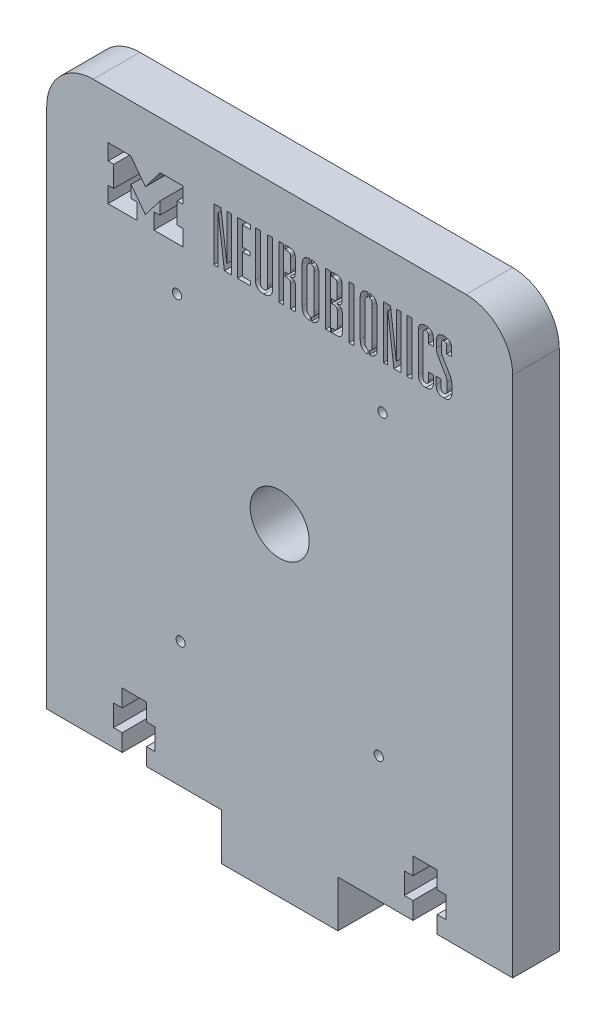
from build123d import *

# Parameters (mm, degrees)
SKETCH1_W             = 127
SKETCH1_H             = 155
BOSS_EXTRUDE1_DEPTH   = 12.7
SKETCH2_W             = 6.604
SKETCH2_H             = 4.699
SKETCH2_H_2           = 5.842
SKETCH2_W_2           = 2.3622
CUT_EXTRUDE1_DEPTH    = 201.786677845
FILLET1_R             = 12.7
SKETCH11_W            = 31.75
SKETCH11_H            = 12.7
BOSS_EXTRUDE2_DEPTH   = 12.7
CUT_EXTRUDE9_DEPTH    = 201.786677845
SKETCH19_W            = 1.320165
SKETCH19_H            = 14.40446524
CUT_EXTRUDE10_DEPTH   = 201.786677845
SKETCH21_R            = 8.05
CUT_EXTRUDE11_DEPTH   = 201.786677992
M3X0_5_TAPPED_HOLE1_D = 2.5
FILLET2_R             = 0.25


with BuildPart() as part:
    # Sketch1 → Boss-Extrude1 (new body)
    with BuildSketch(Plane.XY):
        with Locations((63.5, 77.5)):
            Rectangle(SKETCH1_W, SKETCH1_H)
    extrude(amount=BOSS_EXTRUDE1_DEPTH)

    # Sketch2 → Cut-Extrude1 (cut, through all)
    with BuildSketch(Plane.XY.offset(12.7)):
        with Locations((23.876, 12.8905)):
            Rectangle(SKETCH2_W, SKETCH2_H)
        with Locations((23.876, 7.62)):
            Rectangle(SKETCH2_W, SKETCH2_H_2)
        with Locations((28.3591, 7.62)):
            Rectangle(SKETCH2_W_2, SKETCH2_H_2)
        with Locations((19.3929, 7.62)):
            Rectangle(SKETCH2_W_2, SKETCH2_H_2)
        with Locations((23.876, 2.3495)):
            Rectangle(SKETCH2_W, SKETCH2_H)
        with Locations((103.124, 2.3495)):
            Rectangle(SKETCH2_W, SKETCH2_H)
        with Locations((103.124, 7.62)):
            Rectangle(SKETCH2_W, SKETCH2_H_2)
        with Locations((107.6071, 7.62)):
            Rectangle(SKETCH2_W_2, SKETCH2_H_2)
        with Locations((103.124, 12.8905)):
            Rectangle(SKETCH2_W, SKETCH2_H)
        with Locations((98.6409, 7.62)):
            Rectangle(SKETCH2_W_2, SKETCH2_H_2)
    extrude(amount=-CUT_EXTRUDE1_DEPTH, mode=Mode.SUBTRACT)

    # Fillet1
    fillet1_edges = [part.edges().sort_by_distance(p)[0] for p in [
        (0, 155, 6.35),
        (127, 155, 6.35),
    ]]
    fillet(fillet1_edges, radius=FILLET1_R)

    # Sketch11 → Boss-Extrude2 (add)
    with BuildSketch(Plane.XZ):
        with Locations((63.5, 6.35)):
            Rectangle(SKETCH11_W, SKETCH11_H)
    extrude(amount=BOSS_EXTRUDE2_DEPTH)

    # Sketch20 → Cut-Extrude9 (cut, through all)
    with BuildSketch(Plane.XY.offset(12.7)):
        Polygon((22.97667018, 131.97336552), (24.604291259, 131.97336552), (24.604291259, 127.640619868), (16.714850296, 127.640619868), (16.714850296, 131.97336552), (18.254329992, 131.97336552), (18.254329992, 137.700621193), (16.714056676, 137.700621193), (16.714056676, 142.045085108), (22.890341603, 142.045085108), (26.901674355, 136.730226684), (30.913007108, 142.045085108), (37.089292035, 142.045085108), (37.089292035, 137.700621193), (35.549018719, 137.700621193), (35.549018719, 131.97336552), (37.088498415, 131.97336552), (37.088498415, 127.640619868), (29.199057452, 127.640619868), (29.199057452, 131.97336552), (30.826678531, 131.97336552), (30.826678531, 135.321098969), (26.901674355, 130.12062252), (22.97667018, 135.321098969), align=None)
    extrude(amount=-CUT_EXTRUDE9_DEPTH, mode=Mode.SUBTRACT)

    # Sketch19 → Cut-Extrude10 (cut, through all)
    with BuildSketch(Plane.XY.offset(12.7)):
        with BuildLine():
            Line((64.919332717, 135.678954152), (64.919332717, 134.564150108))
            Line((64.919332717, 134.564150108), (65.415267123, 134.564150108))
            add(Edge.make_bspline(
                [(66.456730818, 133.684040108), (66.456730818, 134.388128108), (66.031344123, 134.564150108), (65.415267123, 134.564150108)],
                knots=[0, 0, 0, 0, 1, 1, 1, 1], degree=3))
            Line((66.456730818, 133.684040108), (66.442061927, 133.684023484))
            Line((66.442061927, 133.684023484), (66.442061927, 127.640603244))
            Line((66.442061927, 127.640603244), (67.796402522, 127.640603244))
            Line((67.796402522, 127.640603244), (67.796402522, 133.801373244))
            add(Edge.make_bspline(
                [(66.300215522, 135.136207722), (67.238999913, 135.077535482), (67.796402522, 134.7988332), (67.796402522, 133.801373244)],
                knots=[0, 0, 0, 0, 1, 1, 1, 1], degree=3))
            Line((66.300215522, 135.136207722), (66.300215522, 135.180227108))
            add(Edge.make_bspline(
                [(67.737728717, 136.735086152), (67.737728717, 135.620282108), (67.312342022, 135.238899152), (66.300215522, 135.180227108)],
                knots=[0, 0, 0, 0, 1, 1, 1, 1], degree=3))
            Line((67.737728717, 136.735086152), (67.737728717, 140.387545586))
            add(Edge.make_bspline(
                [(65.698807413, 142.045085108), (66.960298022, 142.045085108), (67.737728717, 141.825060346), (67.737728717, 140.387545586)],
                knots=[0, 0, 0, 0, 1, 1, 1, 1], degree=3))
            Line((65.698807413, 142.045085108), (64.919332717, 142.045085108))
            Line((64.919332717, 142.045085108), (64.919332717, 140.930280868))
            Line((64.919332717, 140.930280868), (65.378467238, 140.930280868))
            add(Edge.make_bspline(
                [(66.493273629, 139.947490586), (66.493273629, 140.783592152), (66.053218629, 140.930280868), (65.378467238, 140.930280868)],
                knots=[0, 0, 0, 0, 1, 1, 1, 1], degree=3))
            Line((66.493273629, 139.947490586), (66.493273629, 136.720422346))
            add(Edge.make_bspline(
                [(65.510483738, 135.678954152), (66.126560738, 135.678954152), (66.493273629, 135.854976152), (66.493273629, 136.720422346)],
                knots=[0, 0, 0, 0, 1, 1, 1, 1], degree=3))
            Line((65.510483738, 135.678954152), (64.919332717, 135.678954152))
        make_face()
        Polygon((64.569332717, 140.93031325), (64.569332717, 142.045085108), (63.249167717, 142.045085108), (63.249167717, 127.640619868), (64.569332717, 127.640619868), align=None)
        Polygon((46.761773522, 140.44621763), (46.717770955, 140.44621763), (46.717770955, 127.640619868), (45.558959455, 127.640619868), (45.558959455, 142.045085108), (47.480533151, 142.045085108), (49.094067955, 129.723545108), (49.138070522, 129.723545108), (49.138070522, 142.045085108), (50.296882413, 142.045085108), (50.296882413, 127.640619868), (48.419314217, 127.640619868), align=None)
        with BuildLine():
            Line((58.217872413, 142.045085108), (58.217872413, 130.002247586))
            add(Edge.make_bspline(
                [(58.217872413, 130.002247586), (58.217872413, 128.960784868), (58.555247522, 128.65274363), (59.215330022, 128.65274363)],
                knots=[0, 0, 0, 0, 1, 1, 1, 1], degree=3))
            add(Edge.make_bspline(
                [(59.215330022, 128.65274363), (59.890081413, 128.65274363), (60.212788217, 128.975454346), (60.212788217, 130.002247586)],
                knots=[0, 0, 0, 0, 1, 1, 1, 1], degree=3))
            Line((60.212788217, 130.002247586), (60.212788217, 142.045085108))
            Line((60.212788217, 142.045085108), (61.518284913, 142.045085108))
            Line((61.518284913, 142.045085108), (61.518284913, 129.576861868))
            add(Edge.make_bspline(
                [(61.518284913, 129.576861868), (61.518284913, 127.977994586), (60.315467522, 127.523270108), (59.185993413, 127.523270108)],
                knots=[0, 0, 0, 0, 1, 1, 1, 1], degree=3))
            add(Edge.make_bspline(
                [(59.185993413, 127.523270108), (58.085855913, 127.523270108), (56.897707413, 127.977994586), (56.897707413, 129.576861868)],
                knots=[0, 0, 0, 0, 1, 1, 1, 1], degree=3))
            Line((56.897707413, 129.576861868), (56.897707413, 142.045085108))
            Line((56.897707413, 142.045085108), (58.217872413, 142.045085108))
        make_face()
        with BuildLine():
            Line((74.230211032, 139.727460153), (74.230211032, 129.958239152))
            add(Edge.make_bspline(
                [(74.230211032, 129.958239152), (74.230211032, 128.588188835), (73.727002155, 127.598938483), (72.105088423, 127.527419045)],
                knots=[0, 0, 0, 0, 0.962898501, 0.962898501, 0.962898501, 0.962898501], degree=3))
            Line((72.105088423, 127.527419045), (72.105088423, 128.649158115))
            add(Edge.make_bspline(
                [(72.105088423, 128.649158115), (72.774089716, 128.731143819), (72.910046032, 129.260484228), (72.910046032, 129.987578109)],
                knots=[0.082066912, 0.082066912, 0.082066912, 0.082066912, 1, 1, 1, 1], degree=3))
            Line((72.910046032, 129.987578109), (72.910046032, 139.683457587))
            add(Edge.make_bspline(
                [(72.910046032, 139.683457587), (72.910046032, 140.410551468), (72.774089716, 140.939891712), (72.105088423, 141.021877389)],
                knots=[0, 0, 0, 0, 0.917933088, 0.917933088, 0.917933088, 0.917933088], degree=3))
            Line((72.105088423, 141.021877389), (72.105088423, 142.158285932))
            add(Edge.make_bspline(
                [(72.105088423, 142.158285932), (73.727002155, 142.086766486), (74.230211032, 141.097515931), (74.230211032, 139.727460153)],
                knots=[0.037101499, 0.037101499, 0.037101499, 0.037101499, 1, 1, 1, 1], degree=3))
        make_face()
        Polygon((77.316259413, 134.564150108), (77.316259413, 128.755424108), (77.316259413, 127.640603244), (76.010762717, 127.640603244), (76.010762717, 142.045085108), (77.316259413, 142.045085108), (77.316259413, 140.930280868), (77.316259413, 135.678954152), align=None)
        Polygon((94.625086479, 127.640619868), (92.967546957, 140.44621763), (92.923527571, 140.44621763), (92.923527571, 127.640619868), (91.764715093, 127.640619868), (91.764715093, 142.045085108), (93.686287811, 142.045085108), (95.299824571, 129.723545108), (95.343843957, 129.723545108), (95.343843957, 142.045085108), (96.502656435, 142.045085108), (96.502656435, 127.640619868), align=None)
        with BuildLine():
            Line((104.056932957, 129.547523108), (104.056932957, 131.55710663))
            Line((104.056932957, 131.55710663), (105.377097957, 131.55710663))
            Line((105.377097957, 131.55710663), (105.377097957, 129.503520346))
            add(Edge.make_bspline(
                [(105.377097957, 129.503520346), (105.377097957, 128.286030152), (104.702348717, 127.50860063), (103.323511673, 127.50860063)],
                knots=[0, 0, 0, 0, 1, 1, 1, 1], degree=3))
            add(Edge.make_bspline(
                [(103.323511673, 127.50860063), (101.944668957, 127.50860063), (101.269919717, 128.286030152), (101.269919717, 129.503520346)],
                knots=[0, 0, 0, 0, 1, 1, 1, 1], degree=3))
            Line((101.269919717, 129.503520346), (101.269919717, 140.152851346))
            add(Edge.make_bspline(
                [(101.269919717, 140.152851346), (101.269919717, 141.370335868), (101.944668957, 142.147765586), (103.323511673, 142.147765586)],
                knots=[0, 0, 0, 0, 1, 1, 1, 1], degree=3))
            add(Edge.make_bspline(
                [(103.323511673, 142.147765586), (104.702348717, 142.147765586), (105.377097957, 141.370335868), (105.377097957, 140.152851346)],
                knots=[0, 0, 0, 0, 1, 1, 1, 1], degree=3))
            Line((105.377097957, 140.152851346), (105.377097957, 138.275281586))
            Line((105.377097957, 138.275281586), (104.056932957, 138.275281586))
            Line((104.056932957, 138.275281586), (104.056932957, 140.123512586))
            add(Edge.make_bspline(
                [(104.056932957, 140.123512586), (104.056932957, 140.739589586), (103.836908195, 141.047625152), (103.323511673, 141.047625152)],
                knots=[0, 0, 0, 0, 1, 1, 1, 1], degree=3))
            add(Edge.make_bspline(
                [(103.323511673, 141.047625152), (102.810109479, 141.047625152), (102.590084717, 140.754258868), (102.590084717, 140.123512586)],
                knots=[0, 0, 0, 0, 1, 1, 1, 1], degree=3))
            Line((102.590084717, 140.123512586), (102.590084717, 129.547523108))
            add(Edge.make_bspline(
                [(102.590084717, 129.547523108), (102.590084717, 128.931446108), (102.810109479, 128.623410346), (103.323511673, 128.623410346)],
                knots=[0, 0, 0, 0, 1, 1, 1, 1], degree=3))
            add(Edge.make_bspline(
                [(103.323511673, 128.623410346), (103.836908195, 128.623410346), (104.056932957, 128.91677663), (104.056932957, 129.547523108)],
                knots=[0, 0, 0, 0, 1, 1, 1, 1], degree=3))
        make_face()
        with BuildLine():
            Line((107.533370195, 140.064840346), (107.533370195, 138.553983868))
            add(Edge.make_bspline(
                [(107.533370195, 138.553983868), (107.533370195, 138.099259586), (107.606711717, 137.62986563), (107.826736479, 137.263152152)],
                knots=[0, 0, 0, 0, 1, 1, 1, 1], degree=3))
            Line((107.826736479, 137.263152152), (109.924336673, 133.66937063))
            add(Edge.make_bspline(
                [(109.924336673, 133.66937063), (110.217702957, 133.170643586), (110.408394435, 132.554566586), (110.408394435, 131.90915063)],
                knots=[0, 0, 0, 0, 1, 1, 1, 1], degree=3))
            Line((110.408394435, 131.90915063), (110.408394435, 129.635534108))
            add(Edge.make_bspline(
                [(110.408394435, 129.635534108), (110.408394435, 128.286030152), (109.616295435, 127.523270108), (108.296130435, 127.523270108)],
                knots=[0, 0, 0, 0, 1, 1, 1, 1], degree=3))
            add(Edge.make_bspline(
                [(108.296130435, 127.523270108), (106.843951673, 127.523270108), (106.139863673, 128.183355346), (106.139863673, 129.635534108)],
                knots=[0, 0, 0, 0, 1, 1, 1, 1], degree=3))
            Line((106.139863673, 129.635534108), (106.139863673, 131.615784346))
            Line((106.139863673, 131.615784346), (107.460028673, 131.615784346))
            Line((107.460028673, 131.615784346), (107.460028673, 129.723545108))
            add(Edge.make_bspline(
                [(107.460028673, 129.723545108), (107.460028673, 129.048795868), (107.724061673, 128.65274363), (108.296130435, 128.65274363)],
                knots=[0, 0, 0, 0, 1, 1, 1, 1], degree=3))
            add(Edge.make_bspline(
                [(108.296130435, 128.65274363), (108.838865717, 128.65274363), (109.088229435, 129.048795868), (109.088229435, 129.723545108)],
                knots=[0, 0, 0, 0, 1, 1, 1, 1], degree=3))
            Line((109.088229435, 129.723545108), (109.088229435, 131.73312863))
            add(Edge.make_bspline(
                [(109.088229435, 131.73312863), (109.088229435, 132.231861346), (108.985548957, 132.61323863), (108.706846479, 133.111971346)],
                knots=[0, 0, 0, 0, 1, 1, 1, 1], degree=3))
            Line((108.706846479, 133.111971346), (106.770604479, 136.48572263))
            add(Edge.make_bspline(
                [(106.770604479, 136.48572263), (106.418560479, 137.10179963), (106.213205195, 137.585862868), (106.213205195, 138.319284152)],
                knots=[0, 0, 0, 0, 1, 1, 1, 1], degree=3))
            Line((106.213205195, 138.319284152), (106.213205195, 140.050170868))
            add(Edge.make_bspline(
                [(106.213205195, 140.050170868), (106.213205195, 141.473016346), (106.946626479, 142.162434868), (108.281460957, 142.162434868)],
                knots=[0, 0, 0, 0, 1, 1, 1, 1], degree=3))
            add(Edge.make_bspline(
                [(108.281460957, 142.162434868), (109.762978479, 142.162434868), (110.349722195, 141.458346868), (110.349722195, 140.152851346)],
                knots=[0, 0, 0, 0, 1, 1, 1, 1], degree=3))
            Line((110.349722195, 140.152851346), (110.349722195, 138.319284152))
            Line((110.349722195, 138.319284152), (109.029557195, 138.319284152))
            Line((109.029557195, 138.319284152), (109.029557195, 140.064840346))
            Line((109.029557195, 140.064840346), (109.058890479, 140.064840346))
            add(Edge.make_bspline(
                [(109.058890479, 140.064840346), (109.058890479, 140.62223963), (108.912207435, 141.047625152), (108.296130435, 141.047625152)],
                knots=[0, 0, 0, 0, 1, 1, 1, 1], degree=3))
            add(Edge.make_bspline(
                [(108.296130435, 141.047625152), (107.680053435, 141.047625152), (107.533370195, 140.62223963), (107.533370195, 140.064840346)],
                knots=[0, 0, 0, 0, 1, 1, 1, 1], degree=3))
        make_face()
        with BuildLine():
            Line((85.442609195, 129.958239152), (85.442609195, 139.727460153))
            add(Edge.make_bspline(
                [(85.442609195, 139.727460153), (85.442609195, 141.097515797), (85.945819062, 142.086766292), (87.567728479, 142.158285911)],
                knots=[0, 0, 0, 0, 0.962898407, 0.962898407, 0.962898407, 0.962898407], degree=3))
            Line((87.567728479, 142.158285911), (87.567728479, 141.021877309))
            add(Edge.make_bspline(
                [(87.567728479, 141.021877309), (86.898729931, 140.939891377), (86.762774195, 140.410551237), (86.762774195, 139.683457585)],
                knots=[0.0820672, 0.0820672, 0.0820672, 0.0820672, 1, 1, 1, 1], degree=3))
            Line((86.762774195, 139.683457585), (86.762774195, 129.987578107))
            add(Edge.make_bspline(
                [(86.762774195, 129.987578107), (86.762774195, 129.260484455), (86.898729931, 128.731144151), (87.567728479, 128.649158191)],
                knots=[0, 0, 0, 0, 0.917932799, 0.917932799, 0.917932799, 0.917932799], degree=3))
            Line((87.567728479, 128.649158191), (87.567728479, 127.527419066))
            add(Edge.make_bspline(
                [(87.567728479, 127.527419066), (85.945819062, 127.598938677), (85.442609195, 128.58818897), (85.442609195, 129.958239152)],
                knots=[0.037101593, 0.037101593, 0.037101593, 0.037101593, 1, 1, 1, 1], degree=3))
        make_face()
        with Locations((98.849617217, 134.842852488)):
            Rectangle(SKETCH19_W, SKETCH19_H)
        Polygon((53.318593022, 135.678954152), (55.386851522, 135.678954152), (55.386851522, 134.564150108), (53.318593022, 134.564150108), (53.318593022, 128.755424108), (55.489531413, 128.755424108), (55.489531413, 127.640619868), (51.998428022, 127.640619868), (51.998428022, 142.045085108), (55.489531413, 142.045085108), (55.489531413, 140.930280868), (53.318593022, 140.930280868), align=None)
        with BuildLine():
            Line((80.499323717, 140.387545586), (80.499323717, 136.735086152))
            add(Edge.make_bspline(
                [(80.499323717, 136.735086152), (80.499323717, 135.620282108), (80.073938195, 135.224235346), (79.061810522, 135.180227108)],
                knots=[0, 0, 0, 0, 1, 1, 1, 1], degree=3))
            Line((79.061810522, 135.180227108), (79.061810522, 135.136207722))
            add(Edge.make_bspline(
                [(79.061810522, 135.136207722), (79.985927195, 135.092188336), (80.557995957, 134.7988332), (80.557995957, 133.801373244)],
                knots=[0, 0, 0, 0, 1, 1, 1, 1], degree=3))
            Line((80.557995957, 133.801373244), (80.557995957, 129.298142962))
            add(Edge.make_bspline(
                [(80.557995957, 129.298142962), (80.557995957, 127.860633482), (79.780566435, 127.640603244), (78.460402413, 127.640603244)],
                knots=[0, 0, 0, 0, 1, 1, 1, 1], degree=3))
            Line((78.460402413, 127.640603244), (77.666259413, 127.640603244))
            Line((77.666259413, 127.640603244), (77.666259413, 128.755424108))
            Line((77.666259413, 128.755424108), (78.088026717, 128.755424108))
            add(Edge.make_bspline(
                [(78.088026717, 128.755424108), (78.762777522, 128.755424108), (79.202832522, 128.902107152), (79.202832522, 129.738214586)],
                knots=[0, 0, 0, 0, 1, 1, 1, 1], degree=3))
            Line((79.202832522, 129.738214586), (79.202832522, 133.684040108))
            add(Edge.make_bspline(
                [(79.202832522, 133.684040108), (79.202832522, 134.388128108), (78.777446413, 134.564150108), (78.161369413, 134.564150108)],
                knots=[0, 0, 0, 0, 1, 1, 1, 1], degree=3))
            Line((78.161369413, 134.564150108), (77.666259413, 134.564150108))
            Line((77.666259413, 134.564150108), (77.666259413, 135.678954152))
            Line((77.666259413, 135.678954152), (78.146701108, 135.678954152))
            add(Edge.make_bspline(
                [(78.146701108, 135.678954152), (78.762778108, 135.678954152), (79.129490413, 135.854976152), (79.129490413, 136.720422346)],
                knots=[0, 0, 0, 0, 1, 1, 1, 1], degree=3))
            Line((79.129490413, 136.720422346), (79.129490413, 139.947490586))
            add(Edge.make_bspline(
                [(79.129490413, 139.947490586), (79.129490413, 140.783592152), (78.689435413, 140.930280868), (78.014684608, 140.930280868)],
                knots=[0, 0, 0, 0, 1, 1, 1, 1], degree=3))
            Line((78.014684608, 140.930280868), (77.666259413, 140.930280868))
            Line((77.666259413, 140.930280868), (77.666259413, 142.045085108))
            Line((77.666259413, 142.045085108), (78.460402413, 142.045085108))
            add(Edge.make_bspline(
                [(78.460402413, 142.045085108), (79.721893022, 142.045085108), (80.499323717, 141.825060346), (80.499323717, 140.387545586)],
                knots=[0, 0, 0, 0, 1, 1, 1, 1], degree=3))
        make_face()
        with BuildLine():
            Line((88.722688435, 129.987578107), (88.722688435, 139.683457585))
            add(Edge.make_bspline(
                [(88.722688435, 139.683457585), (88.722688435, 140.410551689), (88.586732366, 140.939892034), (87.917728479, 141.021877462)],
                knots=[0, 0, 0, 0, 0.917933369, 0.917933369, 0.917933369, 0.917933369], degree=3))
            Line((87.917728479, 141.021877462), (87.917728479, 142.158285937))
            add(Edge.make_bspline(
                [(87.917728479, 142.158285937), (89.539643443, 142.086766539), (90.042853435, 141.097515968), (90.042853435, 139.727460153)],
                knots=[0.037101473, 0.037101473, 0.037101473, 0.037101473, 1, 1, 1, 1], degree=3))
            Line((90.042853435, 139.727460153), (90.042853435, 129.958239152))
            add(Edge.make_bspline(
                [(90.042853435, 129.958239152), (90.042853435, 128.588188799), (89.539643443, 127.59893843), (87.917728479, 127.527419039)],
                knots=[0, 0, 0, 0, 0.962898527, 0.962898527, 0.962898527, 0.962898527], degree=3))
            Line((87.917728479, 127.527419039), (87.917728479, 128.649158038))
            add(Edge.make_bspline(
                [(87.917728479, 128.649158038), (88.586732365, 128.731143494), (88.722688435, 129.260484004), (88.722688435, 129.987578107)],
                knots=[0.082066631, 0.082066631, 0.082066631, 0.082066631, 1, 1, 1, 1], degree=3))
        make_face()
        with Locations((83.036976173, 134.842852488)):
            Rectangle(SKETCH19_W, SKETCH19_H)
        with BuildLine():
            Line((70.950130228, 139.683457587), (70.950130228, 129.98757811))
            add(Edge.make_bspline(
                [(70.950130228, 129.98757811), (70.950130228, 129.260484224), (71.086087039, 128.731143814), (71.755088423, 128.649158115)],
                knots=[0, 0, 0, 0, 0.917933093, 0.917933093, 0.917933093, 0.917933093], degree=3))
            Line((71.755088423, 128.649158115), (71.755088423, 127.527419042))
            add(Edge.make_bspline(
                [(71.755088423, 127.527419042), (70.133174118, 127.598938457), (69.629965228, 128.588188818), (69.629965228, 129.958239152)],
                knots=[0.037101486, 0.037101486, 0.037101486, 0.037101486, 1, 1, 1, 1], degree=3))
            Line((69.629965228, 129.958239152), (69.629965217, 139.727460152))
            add(Edge.make_bspline(
                [(69.629965217, 139.727460152), (69.629965217, 141.097515951), (70.13317411, 142.086766515), (71.755088423, 142.158285934)],
                knots=[0, 0, 0, 0, 0.962898516, 0.962898516, 0.962898516, 0.962898516], degree=3))
            Line((71.755088423, 142.158285934), (71.755088423, 141.02187739))
            add(Edge.make_bspline(
                [(71.755088423, 141.02187739), (71.086087039, 140.939891718), (70.950130228, 140.410551472), (70.950130228, 139.683457587)],
                knots=[0.082066907, 0.082066907, 0.082066907, 0.082066907, 1, 1, 1, 1], degree=3))
        make_face()
    extrude(amount=-CUT_EXTRUDE10_DEPTH, mode=Mode.SUBTRACT)

    # Sketch21 → Cut-Extrude11 (cut, through all)
    with BuildSketch(Plane.XY.offset(12.7)):
        with Locations((63.5, 75.3825868)):
            Circle(SKETCH21_R)
    extrude(amount=-CUT_EXTRUDE11_DEPTH, mode=Mode.SUBTRACT)

    # M3x0.5 Tapped Hole1 (through all)
    with Locations(Plane.XY.offset(12.7)):
        with Locations((35.50000012, 115.720694002), (36.5, 34.21)):
            m3x0_5_tapped_hole1 = Hole(M3X0_5_TAPPED_HOLE1_D / 2)

    # Mirror3: M3x0.5 Tapped Hole1 across plane
    add(m3x0_5_tapped_hole1.mirror(Plane(origin=(63.5, 0, 0), x_dir=(0, 0, 1), z_dir=(1, 0, 0))), mode=Mode.SUBTRACT)

    # Fillet2
    fillet2_edges = [part.edges().sort_by_distance(p)[0] for p in [
        (24.604291259, 131.97336552, 6.35),
        (29.199057452, 131.97336552, 6.35),
    ]]
    fillet(fillet2_edges, radius=FILLET2_R)


solid = part.part
